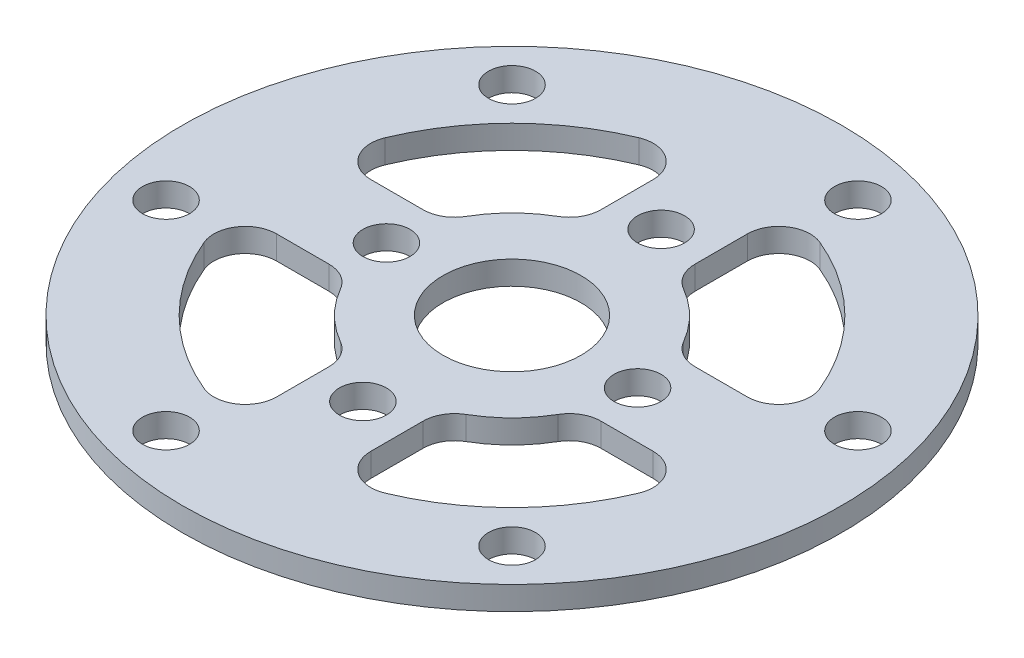
from build123d import *

# Parameters (mm, degrees)
SKETCH1_R           = 21
SKETCH1_R_2         = 1.5
SKETCH1_R_3         = 4.4
BOSS_EXTRUDE1_DEPTH = 1.5


with BuildPart() as part:
    # Sketch1 → Boss-Extrude1 (new body)
    with BuildSketch(Plane(origin=(0, 0, 0), x_dir=(1, 0, 0), z_dir=(0, 1, 0))):
        with Locations(Location((0, 0, 0), (0, 0, 270))):
            Circle(SKETCH1_R)
        with Locations(Location((-8, 0, 0), (0, 0, 270))):
            Circle(SKETCH1_R_2, mode=Mode.SUBTRACT)
        with Locations(Location((8, 0, 0), (0, 0, 270))):
            Circle(SKETCH1_R_2, mode=Mode.SUBTRACT)
        with Locations(Location((0, 9.5, 0), (0, 0, 270))):
            Circle(SKETCH1_R_2, mode=Mode.SUBTRACT)
        with Locations(Location((0, -9.5, 0), (0, 0, 270))):
            Circle(SKETCH1_R_2, mode=Mode.SUBTRACT)
        with Locations(Location((-12.727922061, 12.727922061, 0), (0, 0, 270))):
            Circle(SKETCH1_R_2, mode=Mode.SUBTRACT)
        with Locations(Location((4.658742812, 17.386664873, 0), (0, 0, 270))):
            Circle(SKETCH1_R_2, mode=Mode.SUBTRACT)
        with Locations(Location((17.386664873, 4.658742812, 0), (0, 0, 270))):
            Circle(SKETCH1_R_2, mode=Mode.SUBTRACT)
        with Locations(Location((12.727922061, -12.727922061, 0), (0, 0, 270))):
            Circle(SKETCH1_R_2, mode=Mode.SUBTRACT)
        with Locations(Location((-4.658742812, -17.386664873, 0), (0, 0, 270))):
            Circle(SKETCH1_R_2, mode=Mode.SUBTRACT)
        with Locations(Location((0, 0, 0), (0, 0, 270))):
            Circle(SKETCH1_R_3, mode=Mode.SUBTRACT)
        with Locations(Location((-17.386664873, -4.658742812, 0), (0, 0, 270))):
            Circle(SKETCH1_R_2, mode=Mode.SUBTRACT)
        with BuildLine():
            Line((-8.660254038, 3), (-12, 3))
            ThreePointArc((-12, 3), (-13.664100589, 3.890599608), (-13.846153846, 5.769230769))
            ThreePointArc((-13.846153846, 5.769230769), (-10.606601718, 10.606601718), (-5.769230769, 13.846153846))
            ThreePointArc((-5.769230769, 13.846153846), (-3.890599608, 13.664100589), (-3, 12))
            Line((-3, 12), (-3, 8.660254038))
            ThreePointArc((-3, 8.660254038), (-3.267949192, 7.660254038), (-4, 6.92820323))
            ThreePointArc((-4, 6.92820323), (-5.656854249, 5.656854249), (-6.92820323, 4))
            ThreePointArc((-6.92820323, 4), (-7.660254038, 3.267949192), (-8.660254038, 3))
        make_face(mode=Mode.SUBTRACT)
        with BuildLine():
            Line((-8.660254038, -3), (-12, -3))
            ThreePointArc((-12, -3), (-13.664100589, -3.890599608), (-13.846153846, -5.769230769))
            ThreePointArc((-13.846153846, -5.769230769), (-10.606601718, -10.606601718), (-5.769230769, -13.846153846))
            ThreePointArc((-5.769230769, -13.846153846), (-3.890599608, -13.664100589), (-3, -12))
            Line((-3, -12), (-3, -8.660254038))
            ThreePointArc((-3, -8.660254038), (-3.267949192, -7.660254038), (-4, -6.92820323))
            ThreePointArc((-4, -6.92820323), (-5.656854249, -5.656854249), (-6.92820323, -4))
            ThreePointArc((-6.92820323, -4), (-7.660254038, -3.267949192), (-8.660254038, -3))
        make_face(mode=Mode.SUBTRACT)
        with BuildLine():
            Line((3, 8.660254038), (3, 12))
            ThreePointArc((3, 12), (3.890599608, 13.664100589), (5.769230769, 13.846153846))
            ThreePointArc((5.769230769, 13.846153846), (10.606601718, 10.606601718), (13.846153846, 5.769230769))
            ThreePointArc((13.846153846, 5.769230769), (13.664100589, 3.890599608), (12, 3))
            Line((12, 3), (8.660254038, 3))
            ThreePointArc((8.660254038, 3), (7.660254038, 3.267949192), (6.92820323, 4))
            ThreePointArc((6.92820323, 4), (5.656854249, 5.656854249), (4, 6.92820323))
            ThreePointArc((4, 6.92820323), (3.267949192, 7.660254038), (3, 8.660254038))
        make_face(mode=Mode.SUBTRACT)
        with BuildLine():
            Line((8.660254038, -3), (12, -3))
            ThreePointArc((12, -3), (13.664100589, -3.890599608), (13.846153846, -5.769230769))
            ThreePointArc((13.846153846, -5.769230769), (10.606601718, -10.606601718), (5.769230769, -13.846153846))
            ThreePointArc((5.769230769, -13.846153846), (3.890599608, -13.664100589), (3, -12))
            Line((3, -12), (3, -8.660254038))
            ThreePointArc((3, -8.660254038), (3.267949192, -7.660254038), (4, -6.92820323))
            ThreePointArc((4, -6.92820323), (5.656854249, -5.656854249), (6.92820323, -4))
            ThreePointArc((6.92820323, -4), (7.660254038, -3.267949192), (8.660254038, -3))
        make_face(mode=Mode.SUBTRACT)
    extrude(amount=BOSS_EXTRUDE1_DEPTH)


solid = part.part
